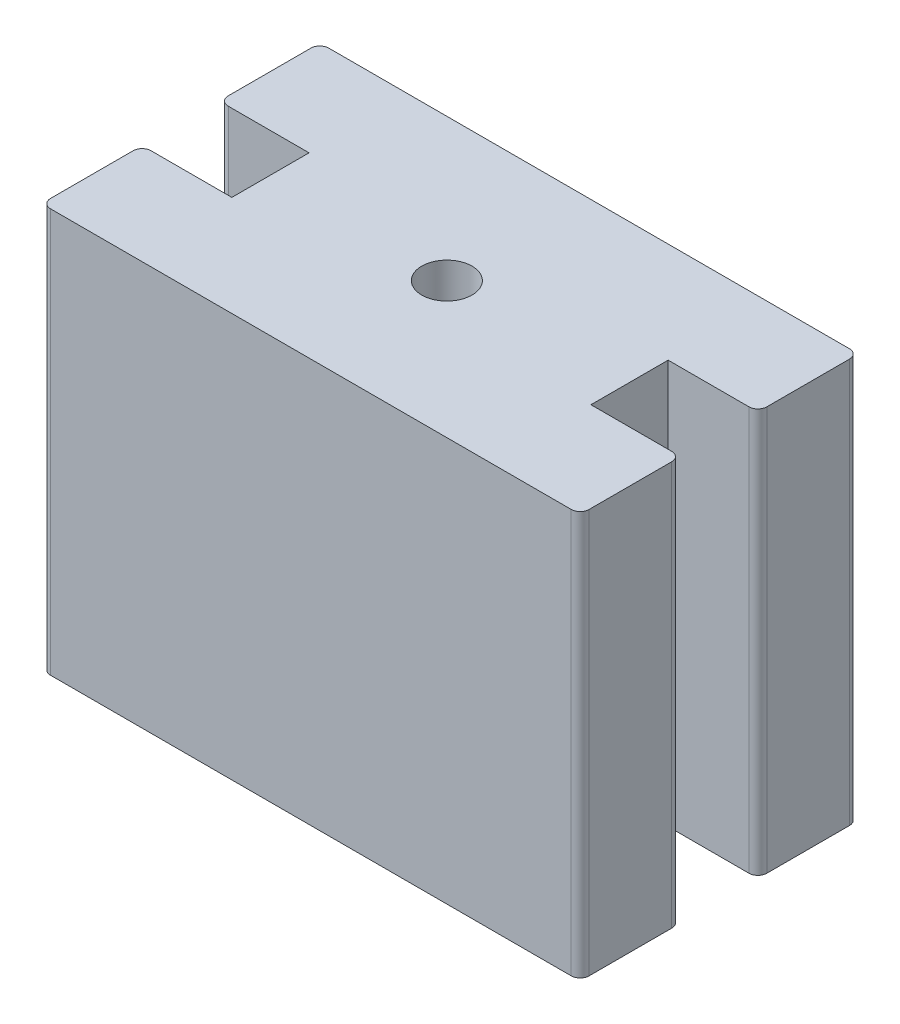
from build123d import *

# Parameters (mm, degrees)
SKETCH1_R           = 2.8
BOSS_EXTRUDE1_DEPTH = 45


with BuildPart() as part:
    # Sketch1 → Boss-Extrude1 (new body)
    with BuildSketch(Plane(origin=(0, 0, 0), x_dir=(1, 0, 0), z_dir=(0, 1, 0))):
        with BuildLine():
            Line((20, -3.95), (20, 4.65))
            Line((20, 4.65), (29, 4.65))
            ThreePointArc((29, 4.65), (29.707106781, 4.942893219), (30, 5.65))
            Line((30, 5.65), (30, 14.85))
            ThreePointArc((30, 14.85), (29.707106781, 15.557106781), (29, 15.85))
            Line((29, 15.85), (20, 15.85))
            Line((20, 15.85), (-20, 15.85))
            Line((-20, 15.85), (-29, 15.85))
            ThreePointArc((-29, 15.85), (-29.707106781, 15.557106781), (-30, 14.85))
            Line((-30, 14.85), (-30, 5.65))
            ThreePointArc((-30, 5.65), (-29.707106781, 4.942893219), (-29, 4.65))
            Line((-29, 4.65), (-20, 4.65))
            Line((-20, 4.65), (-20, -3.95))
            Line((-20, -3.95), (-29, -3.95))
            ThreePointArc((-29, -3.95), (-29.707106781, -4.242893219), (-30, -4.95))
            Line((-30, -4.95), (-30, -14.15))
            ThreePointArc((-30, -14.15), (-29.707106781, -14.857106781), (-29, -15.15))
            Line((-29, -15.15), (-20, -15.15))
            Line((-20, -15.15), (20, -15.15))
            Line((20, -15.15), (29, -15.15))
            ThreePointArc((29, -15.15), (29.707106781, -14.857106781), (30, -14.15))
            Line((30, -14.15), (30, -4.95))
            ThreePointArc((30, -4.95), (29.707106781, -4.242893219), (29, -3.95))
            Line((29, -3.95), (20, -3.95))
        make_face()
        with Locations(Location((0, 0, 0), (0, 0, 90))):
            Circle(SKETCH1_R, mode=Mode.SUBTRACT)
    extrude(amount=BOSS_EXTRUDE1_DEPTH)


solid = part.part
